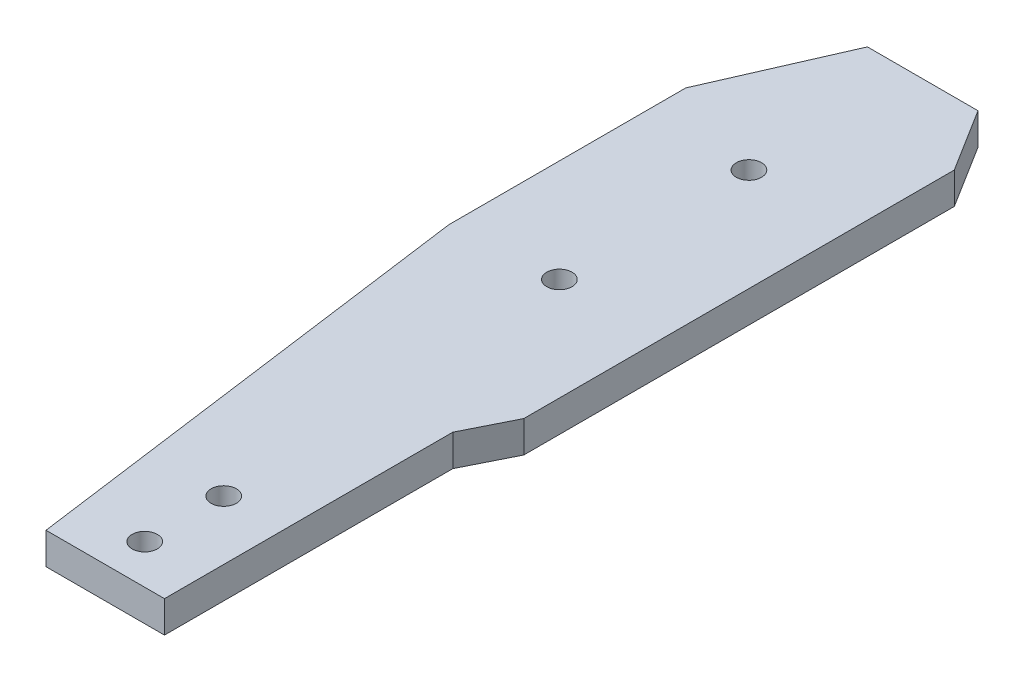
from build123d import *

# Parameters (mm, degrees)
BOSS_EXTRUDE1_DEPTH = 4
SKETCH2_R           = 1.6
CUT_EXTRUDE1_DEPTH  = 101.503731274


with BuildPart() as part:
    # Sketch1 → Boss-Extrude1 (new body)
    with BuildSketch(Plane(origin=(0, 0, 0), x_dir=(1, 0, 0), z_dir=(0, 1, 0))):
        Polygon((0, -54.5), (-3, -60.5), (-3, -97), (-18, -97), (-26, -38), (-26, -8), (-19, 8), (-5, 8), (0, 0), align=None)
    extrude(amount=BOSS_EXTRUDE1_DEPTH)

    # Sketch2 → Cut-Extrude1 (cut, through all)
    with BuildSketch(Plane(origin=(0, 4, 0), x_dir=(1, 0, 0), z_dir=(0, 1, 0))):
        with Locations(Location((-13, -13, 0), (0, 0, 270))):
            Circle(SKETCH2_R)
        with Locations(Location((-13, -37, 0), (0, 0, 270))):
            Circle(SKETCH2_R)
        with Locations(Location((-10.5, -82, 0), (0, 0, 270))):
            Circle(SKETCH2_R)
        with Locations(Location((-10.5, -92, 0), (0, 0, 270))):
            Circle(SKETCH2_R)
    extrude(amount=-CUT_EXTRUDE1_DEPTH, mode=Mode.SUBTRACT)


solid = part.part
